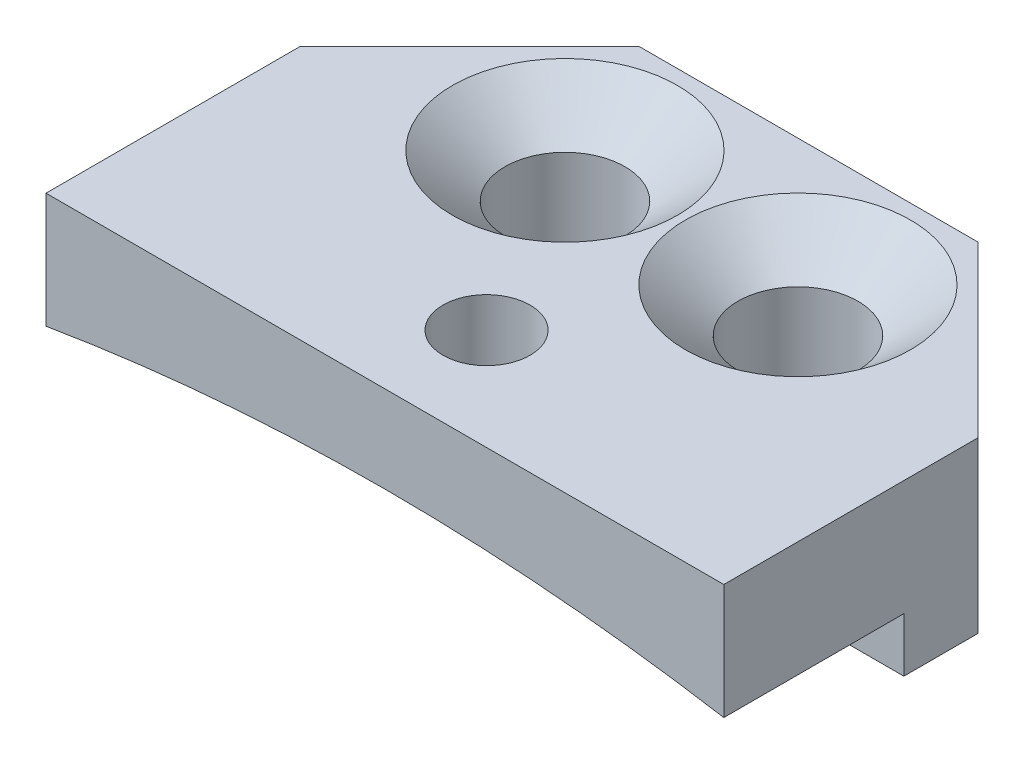
from build123d import *

# Parameters (mm, degrees)
SKETCH1_W                                         = 25.4
SKETCH1_H                                         = 15.875
BOSS_EXTRUDE1_DEPTH                               = 6.35
CHAMFER1_SIZE                                     = 6.35
CUT_EXTRUDE1_DEPTH                                = 6.746875
SKETCH3_R                                         = 1.63195
CUT_EXTRUDE2_DEPTH                                = 17.267034341
CSK_FOR_8_FLAT_HEAD_MACHINE_SCREW_100_D           = 4.4958
CSK_FOR_8_FLAT_HEAD_MACHINE_SCREW_100_CSINK_D     = 8.4328
CSK_FOR_8_FLAT_HEAD_MACHINE_SCREW_100_CSINK_ANGLE = 100


with BuildPart() as part:
    # Sketch1 → Boss-Extrude1 (new body)
    with BuildSketch(Plane(origin=(0, 0, 0), x_dir=(1, 0, 0), z_dir=(0, 1, 0))):
        Rectangle(SKETCH1_W, SKETCH1_H)
    extrude(amount=BOSS_EXTRUDE1_DEPTH)

    # Chamfer1
    chamfer1_edges = [part.edges().sort_by_distance(p)[0] for p in [
        (-12.7, 3.175, -7.9375),
        (12.7, 3.175, -7.9375),
    ]]
    chamfer(chamfer1_edges, length=CHAMFER1_SIZE)

    # Sketch2 → Cut-Extrude1 (cut)
    with BuildSketch(Plane.XY.offset(7.9375)):
        with BuildLine():
            Line((-12.7, 2.030696103), (-12.7, 0))
            Line((-12.7, 0), (12.7, 0))
            Line((12.7, 0), (12.7, 2.030696103))
            ThreePointArc((12.7, 2.030696103), (0, 3.096482857), (-12.7, 2.030696103))
        make_face()
    extrude(amount=-CUT_EXTRUDE1_DEPTH, mode=Mode.SUBTRACT)

    # Sketch3 → Cut-Extrude2 (cut, through all)
    with BuildSketch(Plane(origin=(0, 6.35, 0), x_dir=(1, 0, 0), z_dir=(0, 1, 0))):
        with Locations(Location((0, -4.129280278, 0), (0, 0, 270))):
            Circle(SKETCH3_R)
    extrude(amount=-CUT_EXTRUDE2_DEPTH, mode=Mode.SUBTRACT)

    # CSK for #8 Flat Head Machine Screw (100)1 (through all)
    with Locations(Plane(origin=(0, 6.35, 0), x_dir=(1, 0, 0), z_dir=(0, 1, 0))):
        with Locations((-4.365625, 3.175), (4.365625, 3.175)):
            CounterSinkHole(CSK_FOR_8_FLAT_HEAD_MACHINE_SCREW_100_D / 2, CSK_FOR_8_FLAT_HEAD_MACHINE_SCREW_100_CSINK_D / 2, counter_sink_angle=CSK_FOR_8_FLAT_HEAD_MACHINE_SCREW_100_CSINK_ANGLE)


solid = part.part
